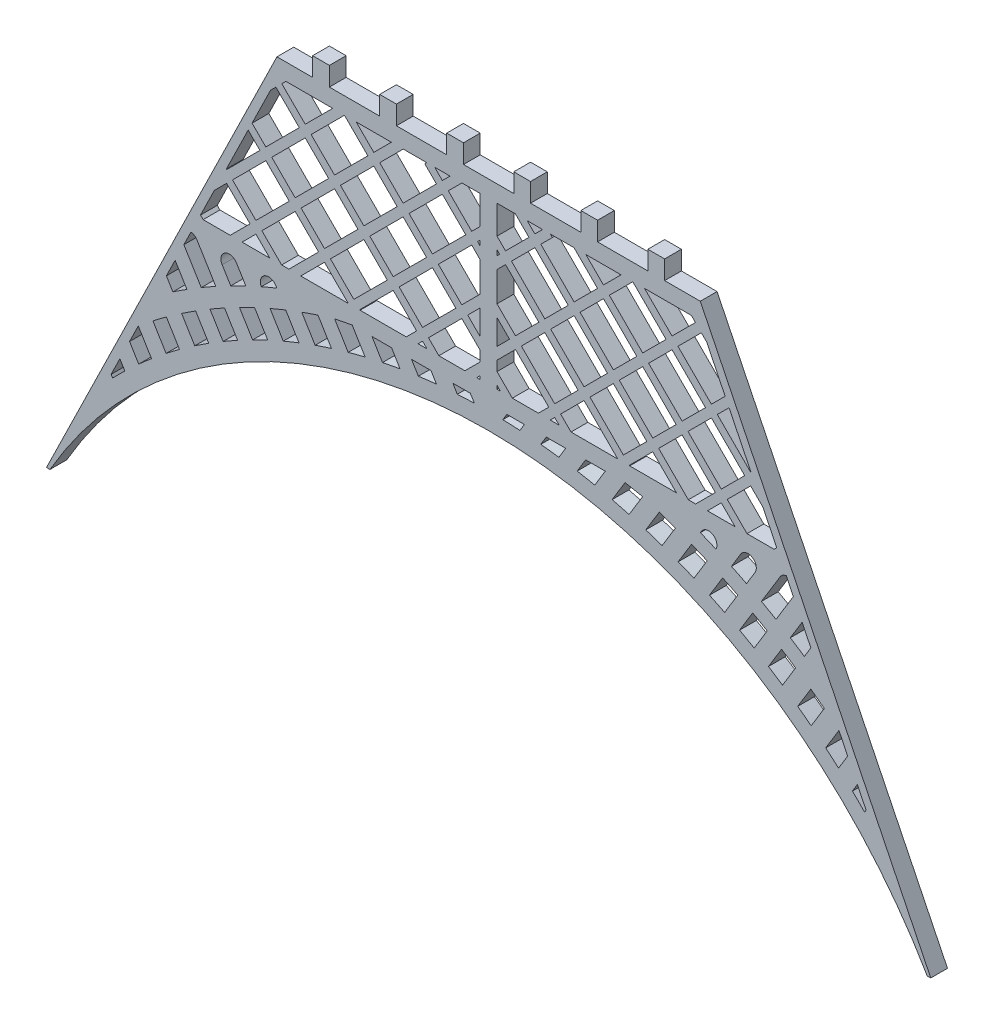
from build123d import *

# Parameters (mm, degrees)
BOSS_EXTRUDE1_DEPTH = 3


with BuildPart() as part:
    # Sketch1 → Boss-Extrude1 (new body)
    with BuildSketch(Plane.XY):
        with BuildLine():
            Line((178.815734463, 242.602478382), (174.315734463, 242.602478382))
            Line((174.315734463, 242.602478382), (174.315734463, 245.968629633))
            Line((174.315734463, 245.968629633), (171.315734463, 245.968629633))
            Line((171.315734463, 245.968629633), (171.315734463, 242.602478382))
            Line((171.315734463, 242.602478382), (162.315734463, 242.602478382))
            Line((162.315734463, 242.602478382), (162.315734463, 245.968629633))
            Line((162.315734463, 245.968629633), (159.315734463, 245.968629633))
            Line((159.315734463, 245.968629633), (159.315734463, 242.602478382))
            Line((159.315734463, 242.602478382), (150.315734463, 242.602478382))
            Line((150.315734463, 242.602478382), (150.315734463, 245.968629633))
            Line((150.315734463, 245.968629633), (147.315734463, 245.968629633))
            Line((147.315734463, 245.968629633), (147.315734463, 242.602478382))
            Line((147.315734463, 242.602478382), (140.931885714, 242.602478382))
            Line((140.931885714, 242.602478382), (99.685562702, 158.325873672))
            Line((99.685562702, 158.325873672), (100.312204363, 158.325873672))
            ThreePointArc((100.312204363, 158.325873672), (178.815734464, 203.602478382), (257.319264563, 158.325873671))
            Line((257.319264563, 158.325873671), (257.945906224, 158.325873671))
            Line((257.945906224, 158.325873671), (216.699583212, 242.602478381))
            Line((216.699583212, 242.602478381), (210.315734463, 242.602478381))
            Line((210.315734463, 242.602478381), (210.315734463, 245.968629633))
            Line((210.315734463, 245.968629633), (207.315734463, 245.968629633))
            Line((207.315734463, 245.968629633), (207.315734463, 242.602478382))
            Line((207.315734463, 242.602478382), (198.315734463, 242.602478382))
            Line((198.315734463, 242.602478382), (198.315734463, 245.968629633))
            Line((198.315734463, 245.968629633), (195.315734463, 245.968629633))
            Line((195.315734463, 245.968629633), (195.315734463, 242.602478382))
            Line((195.315734463, 242.602478382), (186.315734463, 242.602478382))
            Line((186.315734463, 242.602478382), (186.315734463, 245.968629633))
            Line((186.315734463, 245.968629633), (183.315734463, 245.968629633))
            Line((183.315734463, 245.968629633), (183.315734463, 242.602478382))
            Line((183.315734463, 242.602478382), (178.815734463, 242.602478382))
        make_face()
        Polygon((183.618172161, 220.702590818), (187.807511989, 224.891930646), (181.844776259, 230.854666377), (180.315734464, 229.325624582), (180.315734464, 224.005028515), align=None, mode=Mode.SUBTRACT)
        Polygon((181.844776259, 232.97598672), (186.034116087, 237.165326549), (183.596964255, 239.602478381), (180.315734464, 239.602478381), (180.315734464, 234.505028515), align=None, mode=Mode.SUBTRACT)
        Polygon((180.940199697, 210.759242939), (180.315734464, 211.383708172), (180.315734464, 210.759242939), align=None, mode=Mode.SUBTRACT)
        Polygon((183.06152004, 210.759242939), (187.721616087, 210.759242939), (189.580907892, 212.618534744), (183.618172161, 218.581270474), (180.315734464, 215.278832777), (180.315734464, 213.505028515), align=None, mode=Mode.SUBTRACT)
        Polygon((180.784116087, 231.915326549), (180.315734464, 232.383708172), (180.315734464, 231.446944926), align=None, mode=Mode.SUBTRACT)
        Polygon((182.557511989, 219.641930646), (180.315734464, 221.883708172), (180.315734464, 217.400153121), align=None, mode=Mode.SUBTRACT)
        Polygon((200.428832333, 235.391930646), (206.391568064, 229.429194916), (210.580907892, 233.618534744), (204.618172161, 239.581270474), align=None, mode=Mode.SUBTRACT)
        Polygon((199.368172161, 236.452590818), (196.218284598, 239.602478381), (202.518059724, 239.602478381), align=None, mode=Mode.SUBTRACT)
        Polygon((195.178832333, 230.141930646), (201.141568064, 224.179194916), (205.330907892, 228.368534744), (199.368172161, 234.331270474), align=None, mode=Mode.SUBTRACT)
        Polygon((198.307511989, 235.391930646), (194.118172161, 231.202590818), (188.155436431, 237.165326549), (190.241021958, 239.250912076), (189.889455653, 239.602478381), (194.096964255, 239.602478381), align=None, mode=Mode.SUBTRACT)
        Polygon((187.094776259, 236.104666377), (182.905436431, 231.915326549), (188.868172161, 225.952590818), (193.057511989, 230.141930646), align=None, mode=Mode.SUBTRACT)
        Polygon((189.928832333, 224.891930646), (195.891568064, 218.929194916), (200.080907892, 223.118534744), (194.118172161, 229.081270474), align=None, mode=Mode.SUBTRACT)
        Polygon((215.830907892, 238.868534744), (215.096964255, 239.602478381), (206.718284598, 239.602478381), (211.641568064, 234.679194916), align=None, mode=Mode.SUBTRACT)
        Polygon((207.452228235, 228.368534744), (213.438526259, 222.38223672), (217.627866087, 226.571576549), (211.641568064, 232.557874572), align=None, mode=Mode.SUBTRACT)
        Polygon((202.202228235, 223.118534744), (208.188526259, 217.13223672), (212.377866087, 221.321576549), (206.391568064, 227.307874572), align=None, mode=Mode.SUBTRACT)
        Polygon((196.952228235, 217.868534744), (202.938526259, 211.88223672), (207.127866087, 216.071576549), (201.141568064, 222.057874572), align=None, mode=Mode.SUBTRACT)
        Polygon((188.868172161, 223.831270474), (184.678832333, 219.641930646), (190.641568064, 213.679194916), (194.830907892, 217.868534744), align=None, mode=Mode.SUBTRACT)
        Polygon((193.56152004, 210.759242939), (201.815532477, 210.759242939), (201.877866087, 210.821576549), (195.891568064, 216.807874572), (191.702228235, 212.618534744), align=None, mode=Mode.SUBTRACT)
        Polygon((189.842936431, 210.759242939), (191.440199697, 210.759242939), (190.641568064, 211.557874572), align=None, mode=Mode.SUBTRACT)
        Polygon((187.094776259, 238.225986721), (185.718284598, 239.602478381), (188.471267919, 239.602478381), align=None, mode=Mode.SUBTRACT)
        Polygon((218.688526259, 225.510916377), (214.499186431, 221.321576549), (220.461922161, 215.358840818), (224.651261989, 219.548180646), align=None, mode=Mode.SUBTRACT)
        Polygon((213.438526259, 220.260916377), (209.249186431, 216.071576549), (214.56152004, 210.759242939), (215.862324282, 210.759242939), (219.401261989, 214.298180646), align=None, mode=Mode.SUBTRACT)
        Polygon((217.983644626, 210.759242939), (222.940199697, 210.759242939), (220.461922161, 213.237520474), align=None, mode=Mode.SUBTRACT)
        Polygon((204.06152004, 210.759242939), (212.440199697, 210.759242939), (208.188526259, 215.010916377), (203.999186431, 210.821576549), align=None, mode=Mode.SUBTRACT)
        with BuildLine():
            Line((206.381767581, 207.153838336), (203.949348859, 203.168535236))
            ThreePointArc((203.949348859, 203.168535236), (202.436418257, 203.57621493), (200.916881718, 203.958537368))
            Line((200.916881718, 203.958537368), (203.236631849, 207.759242939))
            Line((203.236631849, 207.759242939), (206.381767581, 207.153838336))
        make_face(mode=Mode.SUBTRACT)
        with BuildLine():
            Line((199.701274606, 207.759242939), (197.80806803, 204.657391286))
            ThreePointArc((197.80806803, 204.657391286), (196.235233354, 204.968957589), (194.657297391, 205.253563591))
            Line((194.657297391, 205.253563591), (196.186631849, 207.759242939))
            Line((196.186631849, 207.759242939), (199.701274606, 207.759242939))
        make_face(mode=Mode.SUBTRACT)
        with BuildLine():
            Line((185.226467872, 207.759242939), (184.41811936, 206.434835344))
            ThreePointArc((184.41811936, 206.434835344), (182.889365275, 206.513881252), (181.359523818, 206.567940692))
            Line((181.359523818, 206.567940692), (182.086631849, 207.759242939))
            Line((182.086631849, 207.759242939), (185.226467872, 207.759242939))
        make_face(mode=Mode.SUBTRACT)
        with BuildLine():
            Line((212.258806577, 205.232045397), (209.864134403, 201.308586678))
            ThreePointArc((209.864134403, 201.308586678), (208.407545508, 201.806765417), (206.942968372, 202.280945843))
            Line((206.942968372, 202.280945843), (209.354979636, 206.232813127))
            ThreePointArc((209.354979636, 206.232813127), (210.810806199, 205.743783487), (212.258806577, 205.232045397))
        make_face(mode=Mode.SUBTRACT)
        with BuildLine():
            Line((217.931458895, 202.975382949), (215.563374284, 199.095485601))
            ThreePointArc((215.563374284, 199.095485601), (214.160600782, 199.680177869), (212.748528366, 200.242040875))
            Line((212.748528366, 200.242040875), (215.128548538, 204.141493583))
            ThreePointArc((215.128548538, 204.141493583), (216.534510409, 203.569270732), (217.931458895, 202.975382949))
        make_face(mode=Mode.SUBTRACT)
        with BuildLine():
            Line((223.406169762, 200.394410927), (221.054547615, 196.541485872))
            ThreePointArc((221.054547615, 196.541485872), (219.703906879, 197.210035498), (218.342687917, 197.856774965))
            Line((218.342687917, 197.856774965), (220.701298592, 201.721150104))
            ThreePointArc((220.701298592, 201.721150104), (222.058822679, 201.068154629), (223.406169762, 200.394410927))
        make_face(mode=Mode.SUBTRACT)
        with BuildLine():
            Line((228.686865394, 197.495562089), (226.342190295, 193.65401916))
            ThreePointArc((226.342190295, 193.65401916), (225.042725578, 194.404915669), (223.731400074, 195.134901658))
            Line((223.731400074, 195.134901658), (226.078372691, 198.980208868))
            ThreePointArc((226.078372691, 198.980208868), (227.388291754, 198.247852311), (228.686865394, 197.495562089))
        make_face(mode=Mode.SUBTRACT)
        with BuildLine():
            Line((233.760519034, 194.291432101), (231.413546417, 190.446124891))
            ThreePointArc((231.413546417, 190.446124891), (230.164813578, 191.278663429), (228.902905743, 192.091093571))
            Line((228.902905743, 192.091093571), (231.247580842, 195.9326365))
            ThreePointArc((231.247580842, 195.9326365), (232.510320843, 195.121636028), (233.760519034, 194.291432101))
        make_face(mode=Mode.SUBTRACT)
        with BuildLine():
            Line((238.90028506, 190.574255774), (236.540826567, 186.708491561))
            ThreePointArc((236.540826567, 186.708491561), (235.345948135, 187.627687792), (234.136435259, 188.527540437))
            Line((234.136435259, 188.527540437), (236.488661367, 192.381455027))
            ThreePointArc((236.488661367, 192.381455027), (237.701406482, 191.487107526), (238.90028506, 190.574255774))
        make_face(mode=Mode.SUBTRACT)
        with BuildLine():
            Line((243.081163278, 185.28602652), (241.440947241, 182.598677504))
            ThreePointArc((241.440947241, 182.598677504), (240.301078832, 183.606359452), (239.144998577, 184.595400068))
            Line((239.144998577, 184.595400068), (241.51531124, 188.47894788))
            Line((241.51531124, 188.47894788), (241.520674056, 188.474498211))
            Line((241.520674056, 188.474498211), (243.081163278, 185.28602652))
        make_face(mode=Mode.SUBTRACT)
        with BuildLine():
            Line((233.3591108, 205.150623259), (230.249967958, 200.056567494))
            ThreePointArc((230.249967958, 200.056567494), (228.951943574, 200.809718296), (227.642893221, 201.543537485))
            Line((227.642893221, 201.543537485), (230.998074653, 207.040705734))
            ThreePointArc((230.998074653, 207.040705734), (231.462755748, 207.518080354), (232.088329981, 207.747147869))
            Line((232.088329981, 207.747147869), (233.3591108, 205.150623259))
        make_face(mode=Mode.SUBTRACT)
        with BuildLine():
            Line((222.27299703, 204.29623909), (223.948074653, 207.040705734))
            ThreePointArc((223.948074653, 207.040705734), (226.009895172, 207.539600663), (226.508790101, 205.477780145))
            Line((226.508790101, 205.477780145), (224.973558903, 202.96243951))
            ThreePointArc((224.973558903, 202.96243951), (223.628240643, 203.639387298), (222.27299703, 204.29623909))
        make_face(mode=Mode.SUBTRACT)
        with BuildLine():
            Line((216.898074653, 207.040705734), (216.713430597, 206.738182766))
            ThreePointArc((216.713430597, 206.738182766), (218.1141994, 206.160187581), (219.506156329, 205.561282262))
            ThreePointArc((219.506156329, 205.561282262), (218.918523143, 207.563951971), (216.898074653, 207.040705734))
        make_face(mode=Mode.SUBTRACT)
        with BuildLine():
            Line((188.146335824, 206.136730425), (189.136631849, 207.759242939))
            Line((189.136631849, 207.759242939), (192.614486644, 207.759242939))
            Line((192.614486644, 207.759242939), (191.391048679, 205.754747959))
            ThreePointArc((191.391048679, 205.754747959), (189.770357321, 205.959882965), (188.146335824, 206.136730425))
        make_face(mode=Mode.SUBTRACT)
        Polygon((221.151049793, 230.094760254), (218.688526259, 227.63223672), (212.702228235, 233.618534744), (216.891568064, 237.807874572), (217.840598648, 236.858843988), align=None, mode=Mode.SUBTRACT)
        Polygon((225.766768392, 220.663687048), (225.711922161, 220.608840818), (219.749186431, 226.571576549), (221.848107021, 228.670497139), align=None, mode=Mode.SUBTRACT)
        Polygon((230.38248699, 211.232613842), (229.909116087, 210.759242939), (225.06152004, 210.759242939), (221.522582333, 214.298180646), (225.711922161, 218.487520474), (227.905287387, 216.294155249), align=None, mode=Mode.SUBTRACT)
        with BuildLine():
            Line((236.487279565, 198.758988243), (234.923195183, 201.954805751))
            Line((234.923195183, 201.954805751), (232.810683405, 198.493641905))
            ThreePointArc((232.810683405, 198.493641905), (234.073937685, 197.683523361), (235.325039564, 196.854760718))
            Line((235.325039564, 196.854760718), (236.487279565, 198.758988243))
        make_face(mode=Mode.SUBTRACT)
        with BuildLine():
            Line((246.378105134, 178.549545658), (244.814020752, 181.745363166))
            Line((244.814020752, 181.745363166), (243.923081885, 180.285638574))
            ThreePointArc((243.923081885, 180.285638574), (245.023886296, 179.204273389), (246.106732839, 178.104926137))
            Line((246.106732839, 178.104926137), (246.378105134, 178.549545658))
        make_face(mode=Mode.SUBTRACT)
        Polygon((174.013296767, 220.702590818), (169.823956939, 224.891930646), (175.786692669, 230.854666377), (177.315734464, 229.325624582), (177.315734464, 224.005028515), align=None, mode=Mode.SUBTRACT)
        Polygon((175.786692669, 232.97598672), (171.597352841, 237.165326549), (174.034504674, 239.602478381), (177.315734464, 239.602478381), (177.315734464, 234.505028515), align=None, mode=Mode.SUBTRACT)
        Polygon((176.691269232, 210.759242939), (177.315734464, 211.383708172), (177.315734464, 210.759242939), align=None, mode=Mode.SUBTRACT)
        Polygon((174.569948888, 210.759242939), (169.909852841, 210.759242939), (168.050561036, 212.618534744), (174.013296767, 218.581270474), (177.315734464, 215.278832777), (177.315734464, 213.505028515), align=None, mode=Mode.SUBTRACT)
        Polygon((176.847352841, 231.915326549), (177.315734464, 232.383708172), (177.315734464, 231.446944926), align=None, mode=Mode.SUBTRACT)
        Polygon((175.073956939, 219.641930646), (177.315734464, 221.883708172), (177.315734464, 217.400153121), align=None, mode=Mode.SUBTRACT)
        Polygon((157.202636595, 235.391930646), (151.239900865, 229.429194916), (147.050561036, 233.618534744), (153.013296767, 239.581270474), align=None, mode=Mode.SUBTRACT)
        Polygon((158.263296767, 236.452590818), (161.41318433, 239.602478381), (155.113409204, 239.602478381), align=None, mode=Mode.SUBTRACT)
        Polygon((162.452636595, 230.141930646), (156.489900865, 224.179194916), (152.300561036, 228.368534744), (158.263296767, 234.331270474), align=None, mode=Mode.SUBTRACT)
        Polygon((159.323956939, 235.391930646), (163.513296767, 231.202590818), (169.476032498, 237.165326549), (167.39044697, 239.250912076), (167.742013275, 239.602478381), (163.534504674, 239.602478381), align=None, mode=Mode.SUBTRACT)
        Polygon((170.536692669, 236.104666377), (174.726032498, 231.915326549), (168.763296767, 225.952590818), (164.573956939, 230.141930646), align=None, mode=Mode.SUBTRACT)
        Polygon((167.702636595, 224.891930646), (161.739900865, 218.929194916), (157.550561036, 223.118534744), (163.513296767, 229.081270474), align=None, mode=Mode.SUBTRACT)
        Polygon((141.800561036, 238.868534744), (142.534504674, 239.602478381), (150.91318433, 239.602478381), (145.989900865, 234.679194916), align=None, mode=Mode.SUBTRACT)
        Polygon((150.179240693, 228.368534744), (144.192942669, 222.38223672), (140.003602841, 226.571576549), (145.989900865, 232.557874572), align=None, mode=Mode.SUBTRACT)
        Polygon((155.429240693, 223.118534744), (149.442942669, 217.13223672), (145.253602841, 221.321576549), (151.239900865, 227.307874572), align=None, mode=Mode.SUBTRACT)
        Polygon((160.679240693, 217.868534744), (154.692942669, 211.88223672), (150.503602841, 216.071576549), (156.489900865, 222.057874572), align=None, mode=Mode.SUBTRACT)
        Polygon((168.763296767, 223.831270474), (172.952636595, 219.641930646), (166.989900865, 213.679194916), (162.800561036, 217.868534744), align=None, mode=Mode.SUBTRACT)
        Polygon((164.069948888, 210.759242939), (155.815936451, 210.759242939), (155.753602841, 210.821576549), (161.739900865, 216.807874572), (165.929240693, 212.618534744), align=None, mode=Mode.SUBTRACT)
        Polygon((167.788532498, 210.759242939), (166.191269232, 210.759242939), (166.989900865, 211.557874572), align=None, mode=Mode.SUBTRACT)
        Polygon((170.536692669, 238.225986721), (171.91318433, 239.602478381), (169.160201009, 239.602478381), align=None, mode=Mode.SUBTRACT)
        Polygon((138.942942669, 225.510916377), (143.132282498, 221.321576549), (137.169546767, 215.358840818), (132.980206939, 219.548180646), align=None, mode=Mode.SUBTRACT)
        Polygon((144.192942669, 220.260916377), (148.382282498, 216.071576549), (143.069948888, 210.759242939), (141.769144646, 210.759242939), (138.230206939, 214.298180646), align=None, mode=Mode.SUBTRACT)
        Polygon((139.647824302, 210.759242939), (134.691269232, 210.759242939), (137.169546767, 213.237520474), align=None, mode=Mode.SUBTRACT)
        Polygon((153.569948888, 210.759242939), (145.191269232, 210.759242939), (149.442942669, 215.010916377), (153.632282498, 210.821576549), align=None, mode=Mode.SUBTRACT)
        with BuildLine():
            Line((151.249701348, 207.153838336), (153.682120069, 203.168535236))
            ThreePointArc((153.682120069, 203.168535236), (155.195050671, 203.57621493), (156.714587211, 203.958537368))
            Line((156.714587211, 203.958537368), (154.39483708, 207.759242939))
            Line((154.39483708, 207.759242939), (151.249701348, 207.153838336))
        make_face(mode=Mode.SUBTRACT)
        with BuildLine():
            Line((157.930194323, 207.759242939), (159.823400898, 204.657391286))
            ThreePointArc((159.823400898, 204.657391286), (161.396235575, 204.968957589), (162.974171538, 205.253563591))
            Line((162.974171538, 205.253563591), (161.44483708, 207.759242939))
            Line((161.44483708, 207.759242939), (157.930194323, 207.759242939))
        make_face(mode=Mode.SUBTRACT)
        with BuildLine():
            Line((172.405001057, 207.759242939), (173.213349569, 206.434835344))
            ThreePointArc((173.213349569, 206.434835344), (174.742103653, 206.513881252), (176.271945111, 206.567940692))
            Line((176.271945111, 206.567940692), (175.54483708, 207.759242939))
            Line((175.54483708, 207.759242939), (172.405001057, 207.759242939))
        make_face(mode=Mode.SUBTRACT)
        with BuildLine():
            Line((145.372662352, 205.232045397), (147.767334526, 201.308586678))
            ThreePointArc((147.767334526, 201.308586678), (149.22392342, 201.806765417), (150.688500557, 202.280945843))
            Line((150.688500557, 202.280945843), (148.276489293, 206.232813127))
            ThreePointArc((148.276489293, 206.232813127), (146.82066273, 205.743783487), (145.372662352, 205.232045397))
        make_face(mode=Mode.SUBTRACT)
        with BuildLine():
            Line((139.700010033, 202.975382949), (142.068094645, 199.095485601))
            ThreePointArc((142.068094645, 199.095485601), (143.470868147, 199.680177869), (144.882940563, 200.242040875))
            Line((144.882940563, 200.242040875), (142.502920391, 204.141493583))
            ThreePointArc((142.502920391, 204.141493583), (141.09695852, 203.569270732), (139.700010033, 202.975382949))
        make_face(mode=Mode.SUBTRACT)
        with BuildLine():
            Line((134.225299166, 200.394410927), (136.576921314, 196.541485872))
            ThreePointArc((136.576921314, 196.541485872), (137.92756205, 197.210035498), (139.288781012, 197.856774965))
            Line((139.288781012, 197.856774965), (136.930170337, 201.721150104))
            ThreePointArc((136.930170337, 201.721150104), (135.57264625, 201.068154629), (134.225299166, 200.394410927))
        make_face(mode=Mode.SUBTRACT)
        with BuildLine():
            Line((128.944603535, 197.495562089), (131.289278633, 193.65401916))
            ThreePointArc((131.289278633, 193.65401916), (132.588743351, 194.404915669), (133.900068854, 195.134901658))
            Line((133.900068854, 195.134901658), (131.553096237, 198.980208868))
            ThreePointArc((131.553096237, 198.980208868), (130.243177175, 198.247852311), (128.944603535, 197.495562089))
        make_face(mode=Mode.SUBTRACT)
        with BuildLine():
            Line((123.870949895, 194.291432101), (126.217922512, 190.446124891))
            ThreePointArc((126.217922512, 190.446124891), (127.466655351, 191.278663429), (128.728563186, 192.091093571))
            Line((128.728563186, 192.091093571), (126.383888087, 195.9326365))
            ThreePointArc((126.383888087, 195.9326365), (125.121148086, 195.121636028), (123.870949895, 194.291432101))
        make_face(mode=Mode.SUBTRACT)
        with BuildLine():
            Line((118.731183869, 190.574255774), (121.090642362, 186.708491561))
            ThreePointArc((121.090642362, 186.708491561), (122.285520794, 187.627687792), (123.49503367, 188.527540437))
            Line((123.49503367, 188.527540437), (121.142807561, 192.381455027))
            ThreePointArc((121.142807561, 192.381455027), (119.930062447, 191.487107526), (118.731183869, 190.574255774))
        make_face(mode=Mode.SUBTRACT)
        with BuildLine():
            Line((114.550305651, 185.28602652), (116.190521688, 182.598677504))
            ThreePointArc((116.190521688, 182.598677504), (117.330390097, 183.606359452), (118.486470352, 184.595400068))
            Line((118.486470352, 184.595400068), (116.116157689, 188.47894788))
            Line((116.116157689, 188.47894788), (116.110794873, 188.474498211))
            Line((116.110794873, 188.474498211), (114.550305651, 185.28602652))
        make_face(mode=Mode.SUBTRACT)
        with BuildLine():
            Line((124.272358128, 205.150623259), (127.381500971, 200.056567494))
            ThreePointArc((127.381500971, 200.056567494), (128.679525354, 200.809718296), (129.988575708, 201.543537485))
            Line((129.988575708, 201.543537485), (126.633394275, 207.040705734))
            ThreePointArc((126.633394275, 207.040705734), (126.168713181, 207.518080354), (125.543138948, 207.747147869))
            Line((125.543138948, 207.747147869), (124.272358128, 205.150623259))
        make_face(mode=Mode.SUBTRACT)
        with BuildLine():
            Line((135.358471899, 204.29623909), (133.683394275, 207.040705734))
            ThreePointArc((133.683394275, 207.040705734), (131.621573757, 207.539600663), (131.122678828, 205.477780145))
            Line((131.122678828, 205.477780145), (132.657910025, 202.96243951))
            ThreePointArc((132.657910025, 202.96243951), (134.003228285, 203.639387298), (135.358471899, 204.29623909))
        make_face(mode=Mode.SUBTRACT)
        with BuildLine():
            Line((140.733394275, 207.040705734), (140.918038332, 206.738182766))
            ThreePointArc((140.918038332, 206.738182766), (139.517269529, 206.160187581), (138.1253126, 205.561282262))
            ThreePointArc((138.1253126, 205.561282262), (138.712945786, 207.563951971), (140.733394275, 207.040705734))
        make_face(mode=Mode.SUBTRACT)
        with BuildLine():
            Line((169.485133104, 206.136730425), (168.49483708, 207.759242939))
            Line((168.49483708, 207.759242939), (165.016982285, 207.759242939))
            Line((165.016982285, 207.759242939), (166.24042025, 205.754747959))
            ThreePointArc((166.24042025, 205.754747959), (167.861111608, 205.959882965), (169.485133104, 206.136730425))
        make_face(mode=Mode.SUBTRACT)
        Polygon((136.480419135, 230.094760254), (138.942942669, 227.63223672), (144.929240693, 233.618534744), (140.739900865, 237.807874572), (139.79087028, 236.858843988), align=None, mode=Mode.SUBTRACT)
        Polygon((131.864700537, 220.663687048), (131.919546767, 220.608840818), (137.882282498, 226.571576549), (135.783361907, 228.670497139), align=None, mode=Mode.SUBTRACT)
        Polygon((127.248981938, 211.232613842), (127.722352841, 210.759242939), (132.569948888, 210.759242939), (136.108886595, 214.298180646), (131.919546767, 218.487520474), (129.726181542, 216.294155249), align=None, mode=Mode.SUBTRACT)
        with BuildLine():
            Line((121.144189364, 198.758988243), (122.708273746, 201.954805751))
            Line((122.708273746, 201.954805751), (124.820785523, 198.493641905))
            ThreePointArc((124.820785523, 198.493641905), (123.557531244, 197.683523361), (122.306429365, 196.854760718))
            Line((122.306429365, 196.854760718), (121.144189364, 198.758988243))
        make_face(mode=Mode.SUBTRACT)
        with BuildLine():
            Line((111.253363795, 178.549545658), (112.817448177, 181.745363166))
            Line((112.817448177, 181.745363166), (113.708387043, 180.285638573))
            ThreePointArc((113.708387043, 180.285638573), (112.607582632, 179.204273389), (111.524736089, 178.104926137))
            Line((111.524736089, 178.104926137), (111.253363795, 178.549545658))
        make_face(mode=Mode.SUBTRACT)
    extrude(amount=BOSS_EXTRUDE1_DEPTH)


solid = part.part
